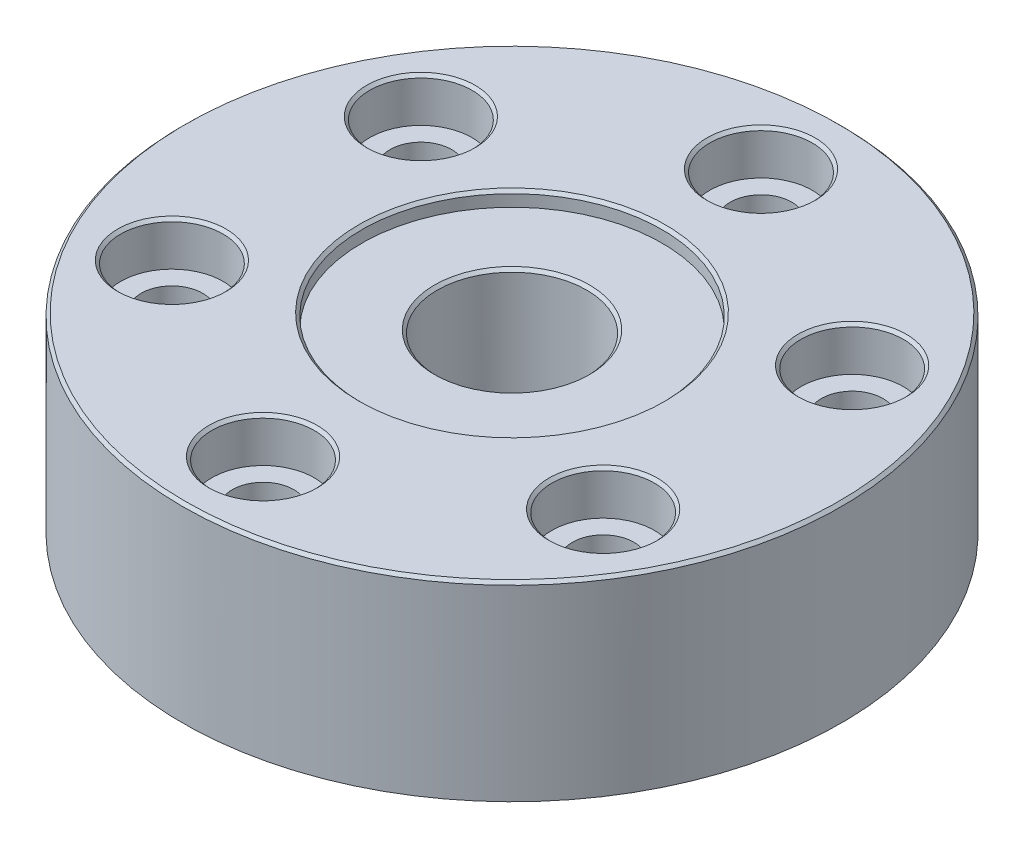
from build123d import *

# Parameters (mm, degrees)
SKETCH_1_W                     = 22.5
SKETCH_1_H                     = 13
HOLE_WIZARD_M3_5_1_D           = 4.2
HOLE_WIZARD_M3_5_1_CBORE_D     = 7
HOLE_WIZARD_M3_5_1_CBORE_DEPTH = 3
HOLE_WIZARD_1_D                = 10.2
HOLE_WIZARD_1_CBORE_D          = 20.5
HOLE_WIZARD_1_CBORE_DEPTH      = 1
CHAMFER_1_SIZE                 = 0.2


with BuildPart() as part:
    # 草图1 → 旋转1 (revolve)
    with BuildSketch(Plane.XY, mode=Mode.PRIVATE) as revolve_1_sk:
        with Locations((11.25, 6.5)):
            Rectangle(SKETCH_1_W, SKETCH_1_H)
    revolve(revolve_1_sk.sketch.rotate(Axis((0, 13, 0), (0, -1, 0)), 270), axis=Axis((0, 13, 0), (0, -1, 0)))

    # M3.5 六角头机械螺钉的柱形沉头孔1 (through all)
    with Locations(Plane(origin=(0, 13, 0), x_dir=(1, 0, 0), z_dir=(0, 1, 0))):
        with Locations((14.722431864, 8.5), (14.722431864, -8.5), (0, -17), (-14.722431864, -8.5), (-14.722431864, 8.5), (0, 17)):
            CounterBoreHole(HOLE_WIZARD_M3_5_1_D / 2, HOLE_WIZARD_M3_5_1_CBORE_D / 2, HOLE_WIZARD_M3_5_1_CBORE_DEPTH)

    # 孔1 (through all)
    with Locations(Plane(origin=(0, 13, 0), x_dir=(1, 0, 0), z_dir=(0, 1, 0))):
        with Locations((0, 0)):
            CounterBoreHole(HOLE_WIZARD_1_D / 2, HOLE_WIZARD_1_CBORE_D / 2, HOLE_WIZARD_1_CBORE_DEPTH)

    # 倒角1
    chamfer_1_edges = [part.edges().sort_by_distance(p)[0] for p in [
        (-3.5, 13, -17),
        (-18.222431864, 13, -8.5),
        (-18.222431864, 13, 8.5),
        (-3.5, 13, 17),
        (11.222431864, 13, 8.5),
        (11.222431864, 13, -8.5),
        (0, 13, 22.5),
        (-10.25, 13, 0),
        (5.1, 12, 0),
    ]]
    chamfer(chamfer_1_edges, length=CHAMFER_1_SIZE)


solid = part.part
